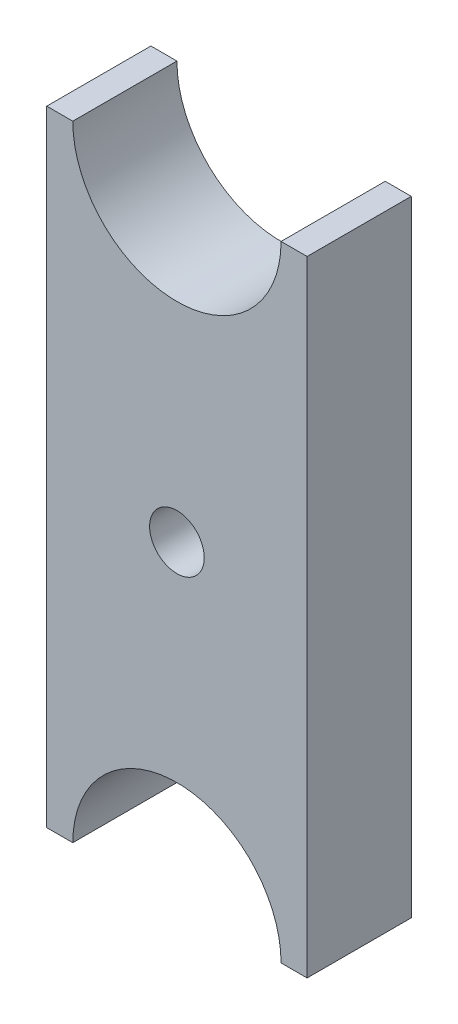
from build123d import *

# Parameters (mm, degrees)
SKETCH1_R           = 5.25
BOSS_EXTRUDE1_DEPTH = 20


with BuildPart() as part:
    # Sketch1 → Boss-Extrude1 (new body)
    with BuildSketch(Plane.XY):
        with BuildLine():
            Line((20, 60), (25, 60))
            Line((25, 60), (25, -60))
            Line((25, -60), (20, -60))
            ThreePointArc((20, -60), (0, -40), (-20, -60))
            Line((-20, -60), (-25, -60))
            Line((-25, -60), (-25, 60))
            Line((-25, 60), (-20, 60))
            ThreePointArc((-20, 60), (0, 40), (20, 60))
        make_face()
        Circle(SKETCH1_R, mode=Mode.SUBTRACT)
    extrude(amount=BOSS_EXTRUDE1_DEPTH)


solid = part.part
